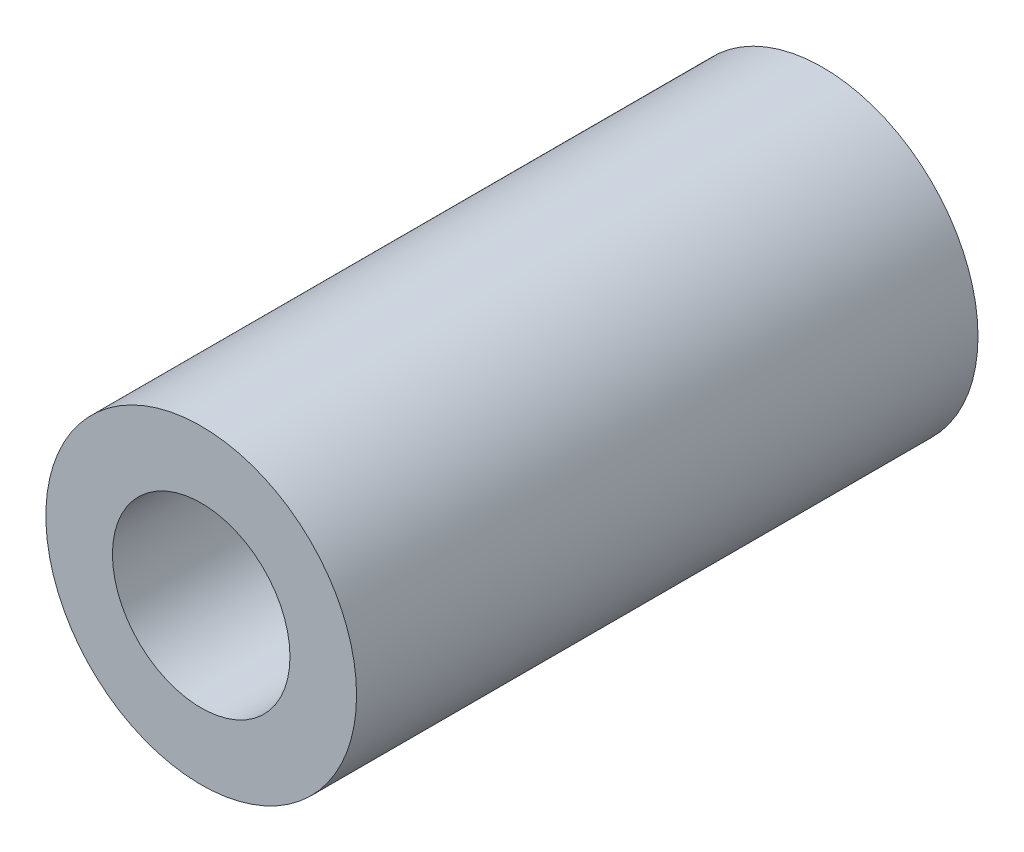
from build123d import *

# Parameters (mm, degrees)
SKETCH1_R           = 3.5
SKETCH1_R_2         = 2
BOSS_EXTRUDE1_DEPTH = 14


with BuildPart() as part:
    # Sketch1 → Boss-Extrude1 (new body)
    with BuildSketch(Plane.XY):
        Circle(SKETCH1_R)
        Circle(SKETCH1_R_2, mode=Mode.SUBTRACT)
    extrude(amount=BOSS_EXTRUDE1_DEPTH)


solid = part.part
